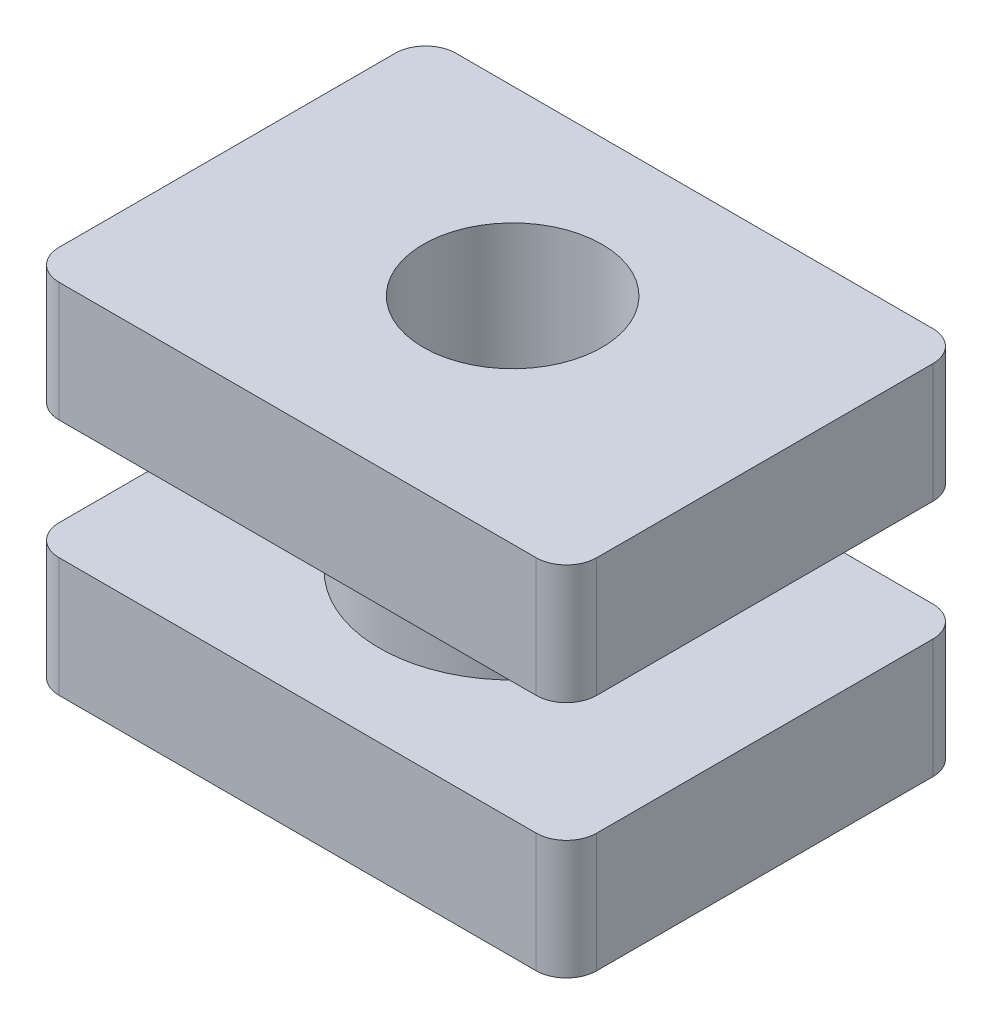
from build123d import *

# Parameters (mm, degrees)
SKETCH1_R           = 1.4986
BOSS_EXTRUDE1_DEPTH = 2
SKETCH2_R           = 1.4986
BOSS_EXTRUDE2_DEPTH = 2
SKETCH3_R           = 1.4986
BOSS_EXTRUDE3_DEPTH = 2
SCALE1_SCALE        = 0.6


with BuildPart() as part:
    # Sketch1 → Boss-Extrude1 (new body)
    with BuildSketch(Plane(origin=(0, 0, 0), x_dir=(1, 0, 0), z_dir=(0, 1, 0))):
        with BuildLine():
            Line((-4.5085, 2.54), (-4.5085, -3.0988))
            ThreePointArc((-4.5085, -3.0988), (-4.359710245, -3.458010245), (-4.0005, -3.6068))
            Line((-4.0005, -3.6068), (4.0005, -3.6068))
            ThreePointArc((4.0005, -3.6068), (4.359710245, -3.458010245), (4.5085, -3.0988))
            Line((4.5085, -3.0988), (4.5085, 2.54))
            ThreePointArc((4.5085, 2.54), (4.359710245, 2.899210245), (4.0005, 3.048))
            Line((4.0005, 3.048), (-4.0005, 3.048))
            ThreePointArc((-4.0005, 3.048), (-4.359710245, 2.899210245), (-4.5085, 2.54))
        make_face()
        with Locations(Location((0, 0, 0), (0, 0, 270))):
            Circle(SKETCH1_R, mode=Mode.SUBTRACT)
    extrude(amount=BOSS_EXTRUDE1_DEPTH)

    # Sketch2 → Boss-Extrude2 (add)
    with BuildSketch(Plane(origin=(0, 2, 0), x_dir=(1, 0, 0), z_dir=(0, 1, 0))):
        with BuildLine():
            Line((1.4986, 1.658407996), (1.4986, 3.048))
            Line((1.4986, 3.048), (-1.4986, 3.048))
            Line((-1.4986, 3.048), (-1.4986, 1.658407996))
            ThreePointArc((-1.4986, 1.658407996), (0, -2.2352), (1.4986, 1.658407996))
        make_face()
        with Locations(Location((0, 0, 0), (0, 0, 270))):
            Circle(SKETCH2_R, mode=Mode.SUBTRACT)
    extrude(amount=BOSS_EXTRUDE2_DEPTH)

    # Sketch3 → Boss-Extrude3 (add)
    with BuildSketch(Plane(origin=(0, 4, 0), x_dir=(1, 0, 0), z_dir=(0, 1, 0))):
        with BuildLine():
            Line((-4.5085, 2.54), (-4.5085, -3.0988))
            ThreePointArc((-4.5085, -3.0988), (-4.359710245, -3.458010245), (-4.0005, -3.6068))
            Line((-4.0005, -3.6068), (4.0005, -3.6068))
            ThreePointArc((4.0005, -3.6068), (4.359710245, -3.458010245), (4.5085, -3.0988))
            Line((4.5085, -3.0988), (4.5085, 2.54))
            ThreePointArc((4.5085, 2.54), (4.359710245, 2.899210245), (4.0005, 3.048))
            Line((4.0005, 3.048), (-4.0005, 3.048))
            ThreePointArc((-4.0005, 3.048), (-4.359710245, 2.899210245), (-4.5085, 2.54))
        make_face()
        with Locations(Location((0, 0, 0), (0, 0, 270))):
            Circle(SKETCH3_R, mode=Mode.SUBTRACT)
    extrude(amount=BOSS_EXTRUDE3_DEPTH)


with BuildPart() as part_1:
    # Scale1: scaled about (0, 3, 0.220798143)
    add(part.part.scale(SCALE1_SCALE).moved(Location((0, 1.2, 0.088319257))))


solid = part_1.part
